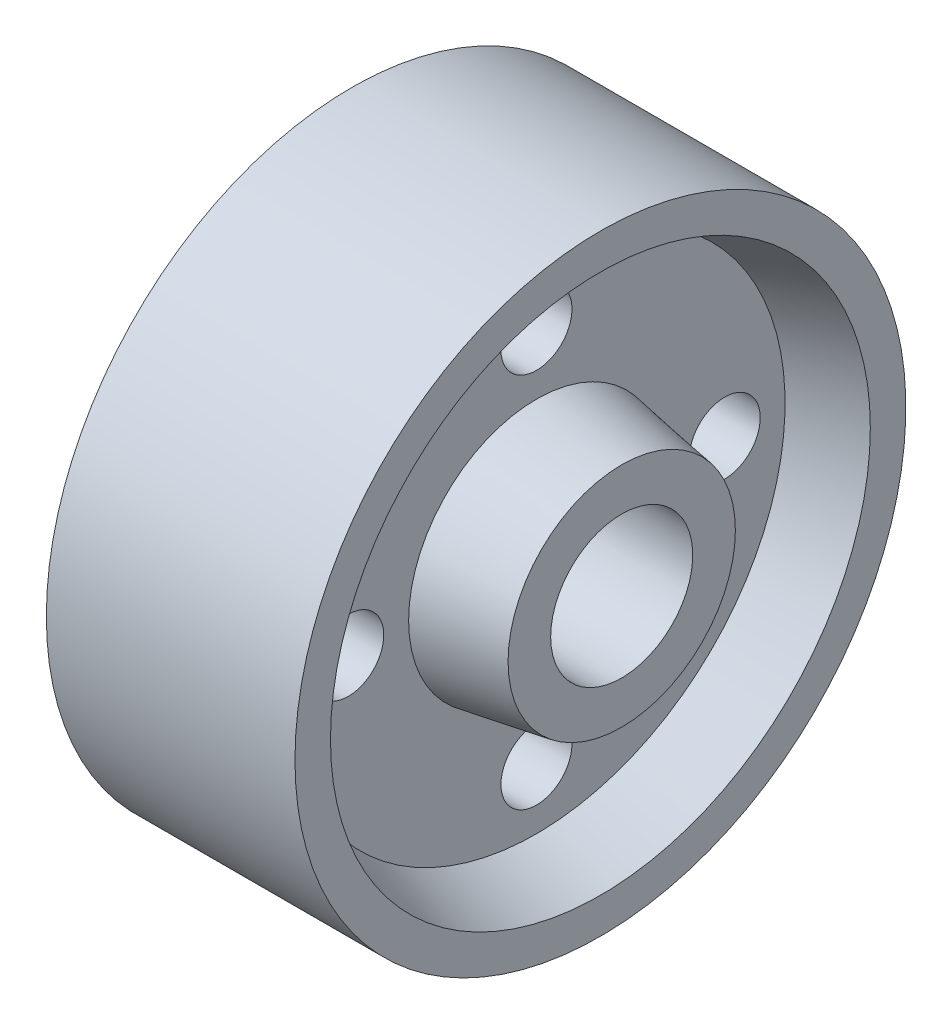
from build123d import *

# Parameters (mm, degrees)
SKETCH5_R          = 127
CUT_EXTRUDE1_DEPTH = 1863.878321308
SKETCH6_R          = 254
CUT_EXTRUDE2_DEPTH = 1863.878321308


with BuildPart() as part:
    # Sketch2 → Revolve2 (revolve)
    with BuildSketch(Plane(origin=(0, 0, 0), x_dir=(1, 0, 0), z_dir=(0, 1, 0)), mode=Mode.PRIVATE) as revolve2_sk:
        Polygon((0, 0), (0, 406.4), (304.8, 457.2), (304.8, 889), (76.2, 965.2), (76.2, 1092.2), (965.2, 1092.2), (965.2, 965.2), (736.6, 889), (736.6, 457.2), (1041.4, 406.4), (1041.4, 0), align=None)
    revolve(revolve2_sk.sketch.rotate(Axis((0, 0, 0), (1, 0, 0)), 180), axis=Axis((0, 0, 0), (1, 0, 0)))

    # Sketch5 → Cut-Extrude1 (cut, through all)
    with BuildSketch(Plane.ZY):
        with Locations((0, 673.1)):
            Circle(SKETCH5_R)
        with Locations((673.1, 0)):
            Circle(SKETCH5_R)
        with Locations((0, -673.1)):
            Circle(SKETCH5_R)
        with Locations((-673.1, 0)):
            Circle(SKETCH5_R)
    extrude(amount=-CUT_EXTRUDE1_DEPTH, mode=Mode.SUBTRACT)

    # Sketch6 → Cut-Extrude2 (cut, through all)
    with BuildSketch(Plane.ZY):
        Circle(SKETCH6_R)
    extrude(amount=-CUT_EXTRUDE2_DEPTH, mode=Mode.SUBTRACT)


solid = part.part
